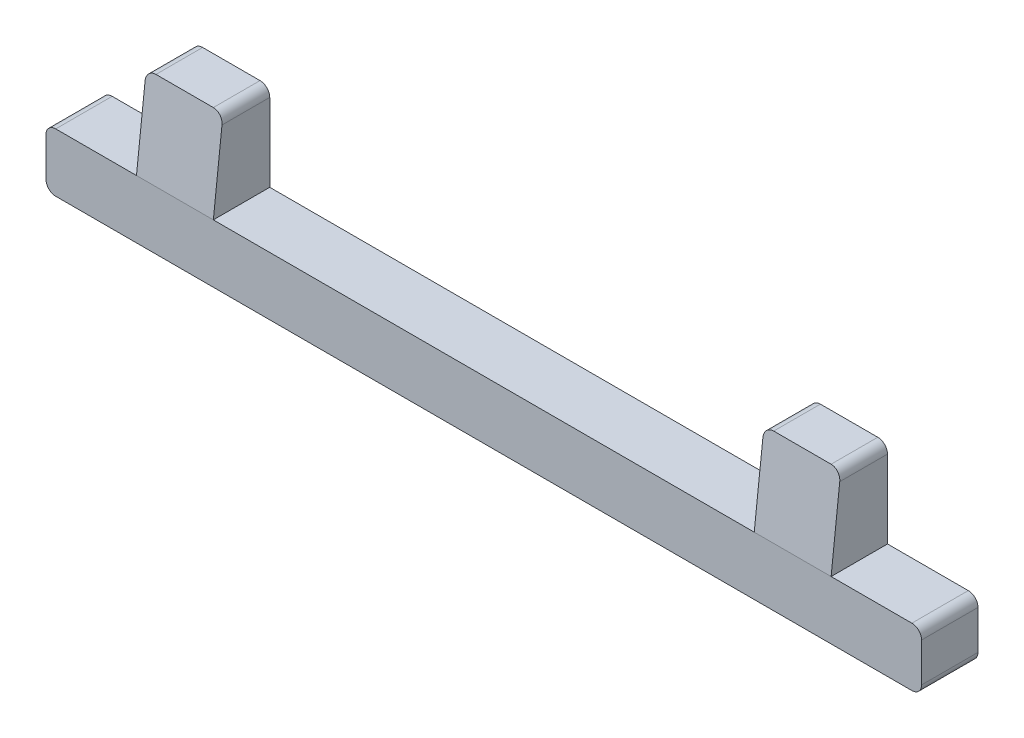
from build123d import *

# Parameters (mm, degrees)
BOSS_EXTRUDE1_DEPTH = 5.8
CUT_EXTRUDE1_DEPTH  = 83.286876232
FILLET1_R           = 1


with BuildPart() as part:
    # Sketch1 → Boss-Extrude1 (new body)
    with BuildSketch(Plane.XY):
        Polygon((0, 0), (90, 0), (90, 6), (80.7, 6), (80.7, 15), (72.8, 15), (72.8, 6), (17.2, 6), (17.2, 15), (9.3, 15), (9.3, 6), (0, 6), align=None)
    extrude(amount=BOSS_EXTRUDE1_DEPTH)

    # Sketch2 → Cut-Extrude1 (cut, through all)
    with BuildSketch(Plane(origin=(80.7, 0, 0), x_dir=(0, 0, -1), z_dir=(1, 0, 0))):
        Polygon((-5.8, 15), (-5.8, 6), (-4.8, 15), align=None)
    extrude(amount=-CUT_EXTRUDE1_DEPTH, mode=Mode.SUBTRACT)

    # Fillet1
    fillet1_edges = [part.edges().sort_by_distance(p)[0] for p in [
        (0, 6, 2.9),
        (90, 6, 2.9),
        (90, 0, 2.9),
        (0, 0, 2.9),
        (9.3, 15, 2.4),
        (17.2, 15, 2.4),
        (72.8, 15, 2.4),
        (80.7, 15, 2.4),
    ]]
    fillet(fillet1_edges, radius=FILLET1_R)


solid = part.part
